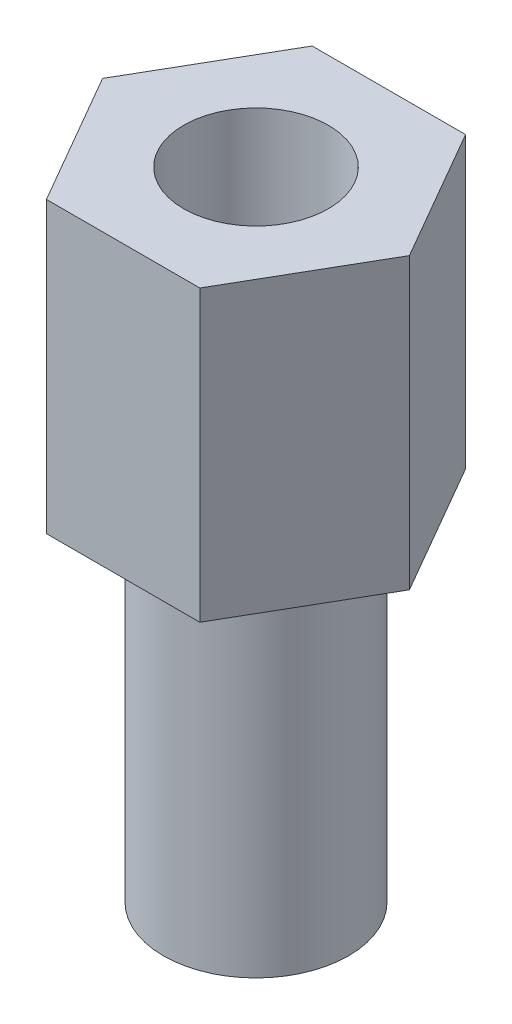
from build123d import *

# Parameters (mm, degrees)
EXTRUDE_1_DEPTH     = 5
SKETCH_6_R          = 1.6
EXTRUDE_2_DEPTH     = 6
SKETCH_7_R          = 1.25
CUT_EXTRUDE_1_DEPTH = 5


with BuildPart() as part:
    # 草图4 → 凸台-拉伸1 (new body)
    with BuildSketch(Plane(origin=(0, 0, 0), x_dir=(1, 0, 0), z_dir=(0, 1, 0))):
        Polygon((1.325, -2.29496732), (2.65, 0), (1.325, 2.29496732), (-1.325, 2.29496732), (-2.65, 0), (-1.325, -2.29496732), align=None)
    extrude(amount=EXTRUDE_1_DEPTH)

    # 草图6 → 凸台-拉伸2 (add)
    with BuildSketch(Plane(origin=(0, 0, 0), x_dir=(-1, 0, 0), z_dir=(0, -1, 0))):
        with Locations(Location((0, 0, 0), (0, 0, 270))):
            Circle(SKETCH_6_R)
    extrude(amount=EXTRUDE_2_DEPTH)

    # 草图7 → 切除-拉伸1 (cut)
    with BuildSketch(Plane(origin=(0, 5, 0), x_dir=(1, 0, 0), z_dir=(0, 1, 0))):
        with Locations(Location((0, 0, 0), (0, 0, 270))):
            Circle(SKETCH_7_R)
    extrude(amount=-CUT_EXTRUDE_1_DEPTH, mode=Mode.SUBTRACT)


solid = part.part
